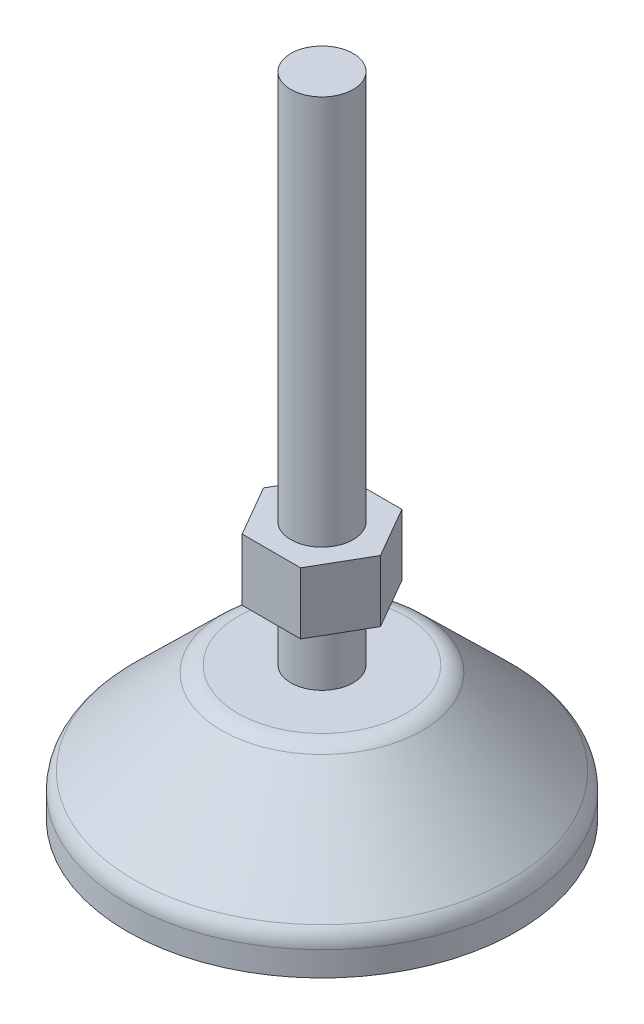
from build123d import *

# Parameters (mm, degrees)
SKETCH_3_R          = 11.768421734
CUT_EXTRUDE_1_DEPTH = 10


with BuildPart() as part:
    # 草图1 → 旋转1 (revolve)
    with BuildSketch(Plane.XY, mode=Mode.PRIVATE) as revolve_1_sk:
        with BuildLine():
            Line((0, 0), (25, 0))
            Line((25, 0), (25, 3.134686744))
            ThreePointArc((25, 3.134686744), (24.76494299, 4.298770187), (24.096606492, 5.280436315))
            Line((24.096606492, 5.280436315), (12.874273498, 16.24574957))
            ThreePointArc((12.874273498, 16.24574957), (11.909645648, 16.878241234), (10.777667007, 17.1))
            Line((10.777667007, 17.1), (4, 17.1))
            Line((4, 17.1), (4, 25.1))
            Line((4, 25.1), (7.5, 25.1))
            Line((7.5, 25.1), (7.5, 33))
            Line((7.5, 33), (4, 33))
            Line((4, 33), (4, 83))
            Line((4, 83), (0, 83))
            Line((0, 83), (0, 0))
        make_face()
    revolve(revolve_1_sk.sketch.rotate(Axis((0, 83, 0), (0, 1, 0)), 270), axis=Axis((0, 83, 0), (0, 1, 0)))

    # 草图3 → 切除-拉伸1 (cut)
    with BuildSketch(Plane(origin=(0, 33, 0), x_dir=(1, 0, 0), z_dir=(0, 1, 0))):
        Circle(SKETCH_3_R)
        Polygon((7.5, 0), (3.75, 6.495190528), (-3.75, 6.495190528), (-7.5, 0), (-3.75, -6.495190528), (3.75, -6.495190528), align=None, mode=Mode.SUBTRACT)
    extrude(amount=-CUT_EXTRUDE_1_DEPTH, mode=Mode.SUBTRACT)


solid = part.part
